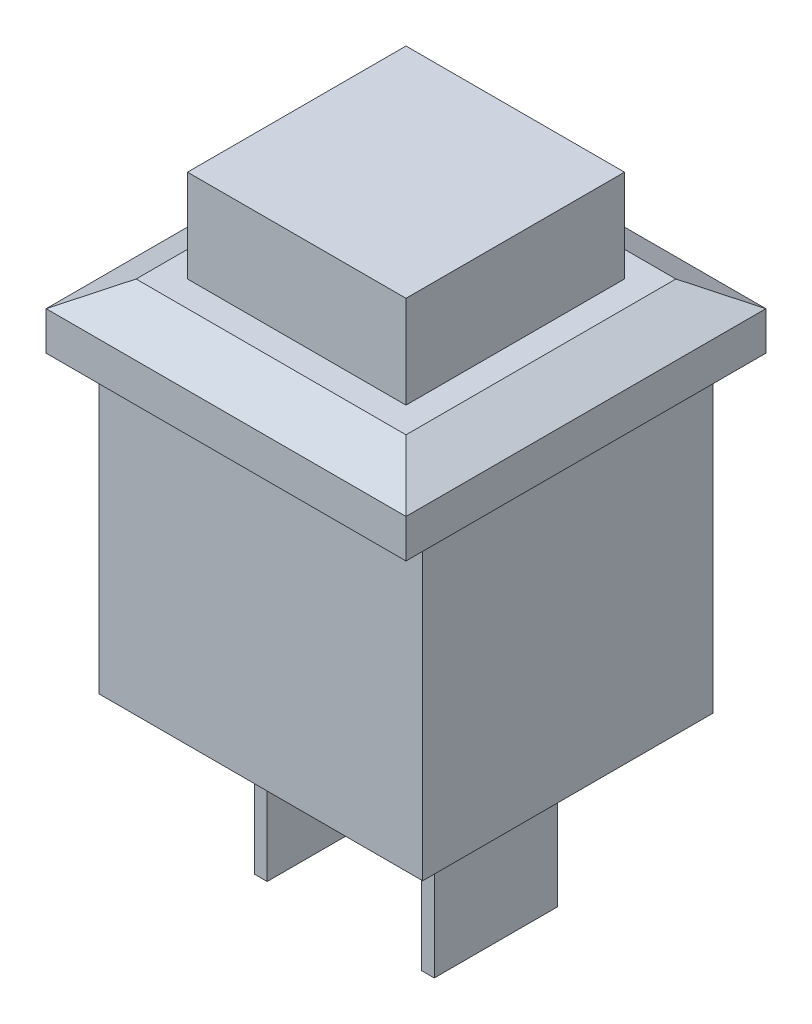
from build123d import *
from OCP.BRepFilletAPI import BRepFilletAPI_MakeChamfer

# Parameters (mm, degrees)
BEZEL_DRAWING_W     = 14
BEZEL_DRAWING_H     = 14
BEZEL_DEPTH         = 2.5
CHAMFER1_SIZE       = 1
CHAMFER1_SIZE2      = 1.75
SKETCH2_W           = 8.5
SKETCH2_H           = 8.5
BOSS_EXTRUDE2_DEPTH = 3.6
SKETCH3_W           = 12.6
SKETCH3_H           = 11.3
BOSS_EXTRUDE3_DEPTH = 11.8
SKETCH4_W           = 0.5
SKETCH4_H           = 4.8
BOSS_EXTRUDE4_DEPTH = 6.3


with BuildPart() as part:
    # Bezel drawing → Bezel (new body)
    with BuildSketch(Plane(origin=(0, 0, 0), x_dir=(1, 0, 0), z_dir=(0, 1, 0))):
        Rectangle(BEZEL_DRAWING_W, BEZEL_DRAWING_H)
    extrude(amount=BEZEL_DEPTH)

    # Chamfer1: one chamfer whose edges measure the first distance from different faces: ONE call of the kernel's chamfer builder (chamfer() names one face for all edges)
    chamfer1_edges_1 = [part.edges().sort_by_distance(p)[0] for p in [
        (-7, 2.5, 0),
    ]]
    chamfer1_side_1 = [part.faces().sort_by_distance(p)[0] for p in [
        (-7, 1.25, 0),
    ]]
    chamfer1_edges_2 = [part.edges().sort_by_distance(p)[0] for p in [
        (0, 2.5, 7),
    ]]
    chamfer1_side_2 = [part.faces().sort_by_distance(p)[0] for p in [
        (0, 1.25, 7),
    ]]
    chamfer1_edges_3 = [part.edges().sort_by_distance(p)[0] for p in [
        (7, 2.5, 0),
    ]]
    chamfer1_side_3 = [part.faces().sort_by_distance(p)[0] for p in [
        (7, 1.25, 0),
    ]]
    chamfer1_edges_4 = [part.edges().sort_by_distance(p)[0] for p in [
        (0, 2.5, -7),
    ]]
    chamfer1_side_4 = [part.faces().sort_by_distance(p)[0] for p in [
        (0, 1.25, -7),
    ]]
    chamfer1 = BRepFilletAPI_MakeChamfer(part.part.solid().wrapped)
    for e in chamfer1_edges_1:
        chamfer1.Add(CHAMFER1_SIZE, CHAMFER1_SIZE2, e.wrapped, chamfer1_side_1[0].wrapped)  # the first distance lies on this face
    for e in chamfer1_edges_2:
        chamfer1.Add(CHAMFER1_SIZE, CHAMFER1_SIZE2, e.wrapped, chamfer1_side_2[0].wrapped)  # the first distance lies on this face
    for e in chamfer1_edges_3:
        chamfer1.Add(CHAMFER1_SIZE, CHAMFER1_SIZE2, e.wrapped, chamfer1_side_3[0].wrapped)  # the first distance lies on this face
    for e in chamfer1_edges_4:
        chamfer1.Add(CHAMFER1_SIZE, CHAMFER1_SIZE2, e.wrapped, chamfer1_side_4[0].wrapped)  # the first distance lies on this face
    add(Compound.cast(chamfer1.Shape()), mode=Mode.REPLACE)

    # Sketch3 → Boss-Extrude3 (add)
    with BuildSketch(Plane.XZ):
        Rectangle(SKETCH3_W, SKETCH3_H)
    extrude(amount=BOSS_EXTRUDE3_DEPTH)

    # Sketch4 → Boss-Extrude4 (add)
    with BuildSketch(Plane.XZ.offset(11.8)):
        with Locations((-3.25, 0)):
            Rectangle(SKETCH4_W, SKETCH4_H)
        with Locations((3.25, 0)):
            Rectangle(SKETCH4_W, SKETCH4_H)
    extrude(amount=BOSS_EXTRUDE4_DEPTH)


with BuildPart() as body_2:
    # Sketch2 → Boss-Extrude2 (new body)
    with BuildSketch(Plane(origin=(0, 2.5, 0), x_dir=(1, 0, 0), z_dir=(0, 1, 0))):
        Rectangle(SKETCH2_W, SKETCH2_H)
    extrude(amount=BOSS_EXTRUDE2_DEPTH)


solid = Compound([part.part, body_2.part])
